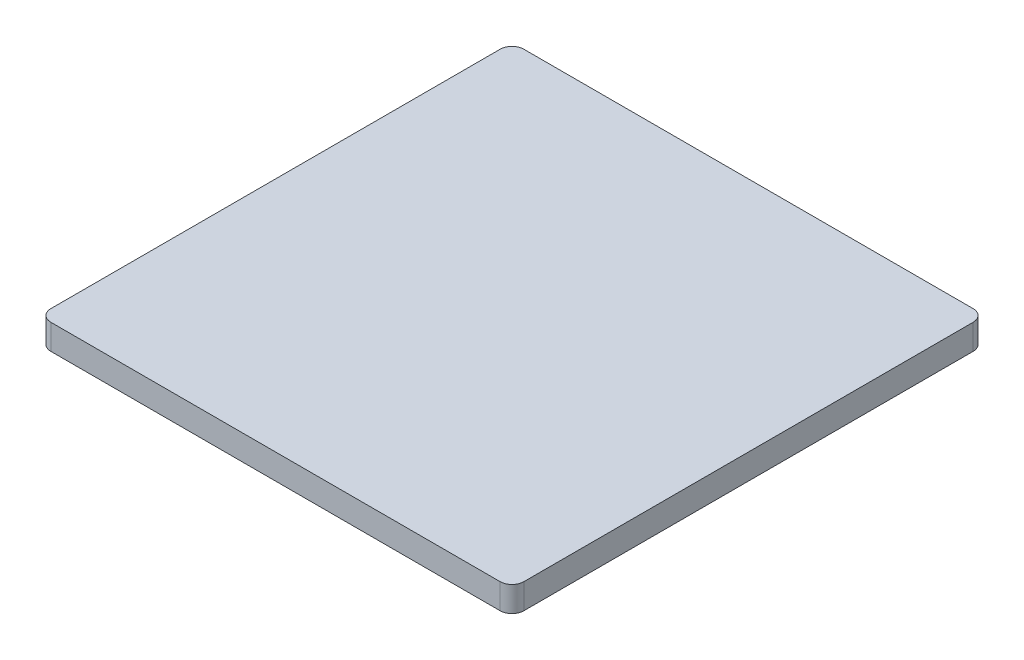
from build123d import *

# Parameters (mm, degrees)
SCHIZZO1_W                   = 30
SCHIZZO1_H                   = 30
ESTRUSIONE_ESTRUSIONE1_DEPTH = 1.6
RACCORDO1_R                  = 0.75


with BuildPart() as part:
    # Schizzo1 → Estrusione-Estrusione1 (new body)
    with BuildSketch(Plane(origin=(0, 0, 0), x_dir=(1, 0, 0), z_dir=(0, 1, 0))):
        with Locations((-40.4430411, -37.031161648)):
            Rectangle(SCHIZZO1_W, SCHIZZO1_H)
    extrude(amount=ESTRUSIONE_ESTRUSIONE1_DEPTH)

    # Raccordo1
    raccordo1_edges = [part.edges().sort_by_distance(p)[0] for p in [
        (-55.4430411, 0.8, 22.031161648),
        (-25.4430411, 0.8, 22.031161648),
        (-25.4430411, 0.8, 52.031161648),
        (-55.4430411, 0.8, 52.031161648),
    ]]
    fillet(raccordo1_edges, radius=RACCORDO1_R)


solid = part.part
